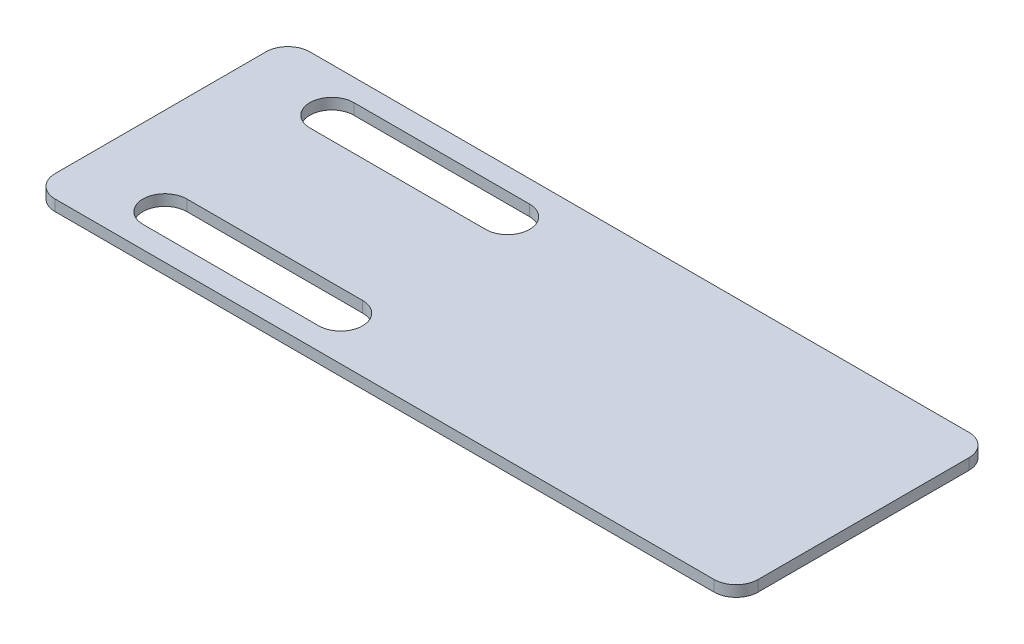
from build123d import *

# Parameters (mm, degrees)
SKETCH1_W           = 203.2
SKETCH1_H           = 73.66
BOSS_EXTRUDE1_DEPTH = 3.175
FILLET1_R           = 6.35


with BuildPart() as part:
    # Sketch1 → Boss-Extrude1 (new body)
    with BuildSketch(Plane(origin=(0, 0, 0), x_dir=(1, 0, 0), z_dir=(0, 1, 0))):
        Rectangle(SKETCH1_W, SKETCH1_H)
        with BuildLine():
            Line((-76.2, -17.78), (-25.4, -17.78))
            ThreePointArc((-25.4, -17.78), (-19.05, -24.13), (-25.4, -30.48))
            Line((-25.4, -30.48), (-76.2, -30.48))
            ThreePointArc((-76.2, -30.48), (-82.55, -24.13), (-76.2, -17.78))
        make_face(mode=Mode.SUBTRACT)
        with BuildLine():
            Line((-76.2, 17.78), (-25.4, 17.78))
            ThreePointArc((-25.4, 17.78), (-19.05, 24.13), (-25.4, 30.48))
            Line((-25.4, 30.48), (-76.2, 30.48))
            ThreePointArc((-76.2, 30.48), (-82.55, 24.13), (-76.2, 17.78))
        make_face(mode=Mode.SUBTRACT)
    extrude(amount=BOSS_EXTRUDE1_DEPTH)

    # Fillet1
    fillet1_edges = [part.edges().sort_by_distance(p)[0] for p in [
        (101.6, 1.5875, 36.83),
        (-101.6, 1.5875, 36.83),
        (-101.6, 1.5875, -36.83),
        (101.6, 1.5875, -36.83),
    ]]
    fillet(fillet1_edges, radius=FILLET1_R)


solid = part.part
